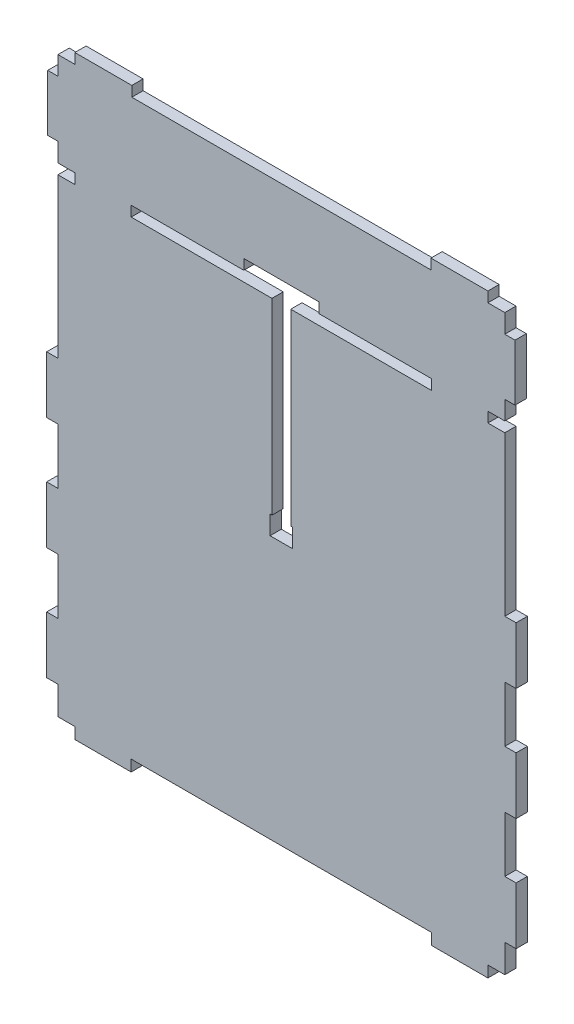
from build123d import *

# Parameters (mm, degrees)
EXTRUDE_1_DEPTH     = 6
CUT_EXTRUDE_1_DEPTH = 10


with BuildPart() as part:
    # Эскиз2 → Бобышка-Вытянуть1 (new body)
    with BuildSketch(Plane.XY):
        Polygon((0, 0), (-9, 0), (-9, 5.45), (0, 5.45), (0, 15.45), (5.45, 15.45), (5.45, 45.45), (0, 45.45), (0, 55.45), (-9, 55.45), (-9, 60.9), (-39.35, 60.9), (-39.35, 55.45), (-198.65, 55.45), (-198.65, 60.9), (-229, 60.9), (-229, 55.45), (-238, 55.45), (-238, 45.45), (-243.45, 45.45), (-243.45, 15.45), (-238, 15.45), (-238, 5.45), (-229, 5.45), (-229, 0), (-238, 0), (-238, -84.65), (-244, -84.65), (-244, -115), (-238, -115), (-238, -144.65), (-244, -144.65), (-244, -175), (-238, -175), (-238, -204.65), (-244, -204.65), (-244, -235), (-238, -235), (-238, -250), (-229, -250), (-229, -256), (-199, -256), (-199, -250), (-39, -250), (-39, -256), (-9, -256), (-9, -250), (0, -250), (0, -235), (6, -235), (6, -204.65), (0, -204.65), (0, -175), (6, -175), (6, -144.65), (0, -144.65), (0, -115), (6, -115), (6, -84.65), (0, -84.65), align=None)
        Polygon((-199, 0), (-199, 5.45), (-139, 5.45), (-139, 10.9), (-99, 10.9), (-99, 5.45), (-39, 5.45), (-39, 0), align=None, mode=Mode.SUBTRACT)
    extrude(amount=EXTRUDE_1_DEPTH)

    # Эскиз4 → Вырез-Вытянуть1 (cut)
    with BuildSketch(Plane.XY.offset(6)):
        Polygon((-114, -100), (-113, -100), (-113, -110), (-125, -110), (-125, -100), (-124, -100), (-124, 0), (-114, 0), align=None)
    extrude(amount=-CUT_EXTRUDE_1_DEPTH, mode=Mode.SUBTRACT)


solid = part.part
